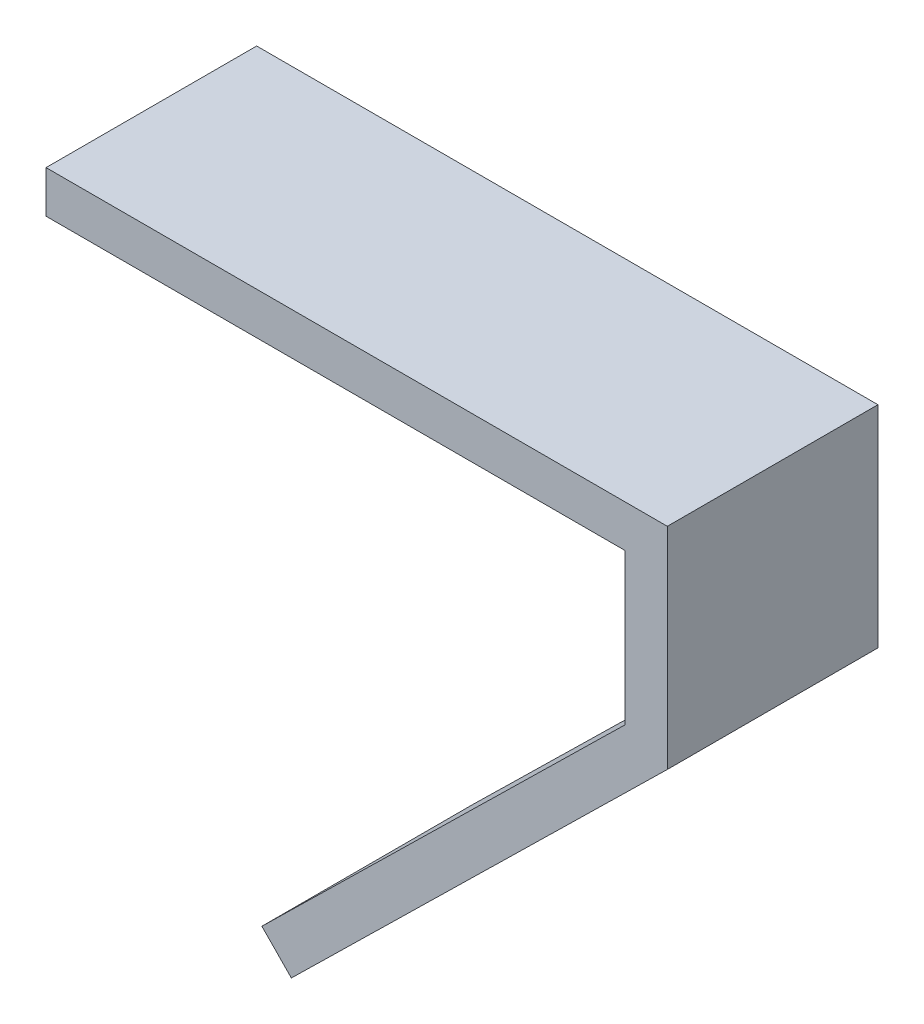
from build123d import *

# Parameters (mm, degrees)
SKETCH2_W           = 20
SKETCH2_H           = 50
BOSS_EXTRUDE1_DEPTH = 4
SKETCH3_W           = 4
SKETCH3_H           = 20
BOSS_EXTRUDE2_DEPTH = 20
SKETCH4_W           = 20
SKETCH4_H           = 4
BOSS_EXTRUDE3_DEPTH = 55


with BuildPart() as part:
    # Sketch2 → Boss-Extrude1 (new body)
    with BuildSketch(Plane(origin=(43.545033316, -44.420173201, 0), x_dir=(0, 0, 1), z_dir=(-0.7000373416081909, 0.7141062388427489, 0))):
        with Locations((18.034703764, 62.678269869)):
            Rectangle(SKETCH2_W, SKETCH2_H)
    extrude(amount=BOSS_EXTRUDE1_DEPTH)

    # Sketch3 → Boss-Extrude2 (add)
    with BuildSketch(Plane.XY.offset(28.034703764)):
        with Locations((104.156632841, 26.957889755)):
            Rectangle(SKETCH3_W, SKETCH3_H)
    extrude(amount=-BOSS_EXTRUDE2_DEPTH)

    # Sketch4 → Boss-Extrude3 (add)
    with BuildSketch(Plane.ZY.offset(-102.156632841)):
        with Locations((18.034703764, 34.957889755)):
            Rectangle(SKETCH4_W, SKETCH4_H)
    extrude(amount=BOSS_EXTRUDE3_DEPTH)


solid = part.part
